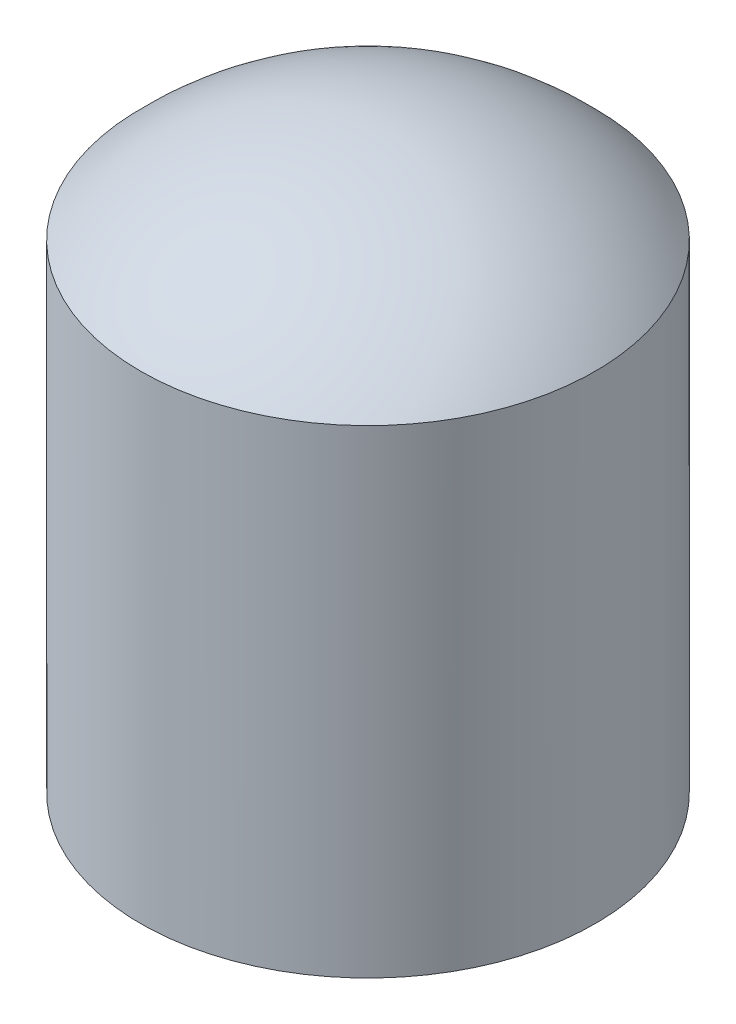
from build123d import *


with BuildPart() as part:
    # Sketch35 → Revolve1 (revolve)
    with BuildSketch(Plane(origin=(0, 0, 0), x_dir=(0, 0, -1), z_dir=(1, 0, 0)), mode=Mode.PRIVATE) as revolve1_sk:
        with BuildLine():
            Line((-17, 0), (-17, 40))
            ThreePointArc((-17, 40), (-9.05604246, 44.637128383), (0, 46.248809497))
            Line((0, 46.248809497), (0, 48.172504657))
            ThreePointArc((0, 48.172504657), (-10.341540412, 46.042723263), (-19, 40))
            Line((-19, 40), (-19, 0))
            Line((-19, 0), (-17, 0))
        make_face()
    revolve(revolve1_sk.sketch.rotate(Axis((0, 46.248809497, 0), (0, 1, 0)), 180), axis=Axis((0, 46.248809497, 0), (0, 1, 0)))


solid = part.part
